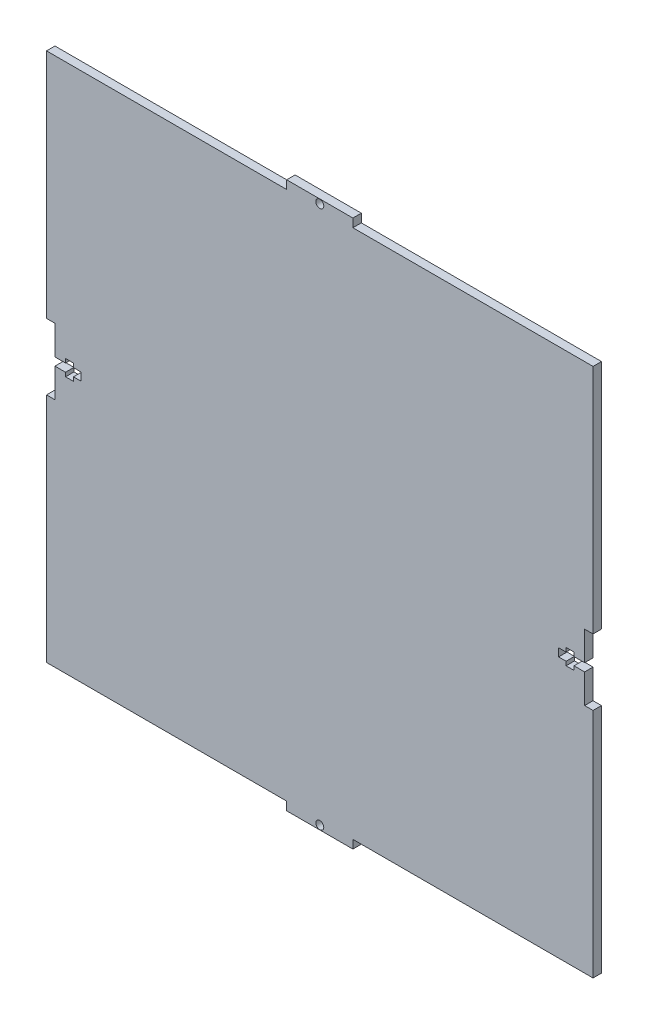
from build123d import *

# Parameters (mm, degrees)
SKETCH1_R           = 1.5
BOSS_EXTRUDE1_DEPTH = 3.18


with BuildPart() as part:
    # Sketch1 → Boss-Extrude1 (new body)
    with BuildSketch(Plane.XY):
        Polygon((-103.18, 100), (-12.5, 100), (-12.5, 103.18), (12.5, 103.18), (12.5, 100), (103.18, 100), (103.18, 12.5), (100, 12.5), (100, 1.5), (96, 1.5), (96, 3), (93, 3), (93, 1.5), (90.18, 1.5), (90.18, -1.5), (93, -1.5), (93, -3), (96, -3), (96, -1.5), (100, -1.5), (100, -12.5), (103.18, -12.5), (103.18, -100), (12.5, -100), (12.5, -103.18), (-12.5, -103.18), (-12.5, -100), (-103.18, -100), (-103.18, -12.5), (-100, -12.5), (-100, -1.5), (-96, -1.5), (-96, -3), (-93, -3), (-93, -1.5), (-90.18, -1.5), (-90.18, 1.5), (-93, 1.5), (-93, 3), (-96, 3), (-96, 1.5), (-100, 1.5), (-100, 12.5), (-103.18, 12.5), align=None)
        with Locations(Location((0, -101.59, 0), (0, 0, 180))):
            Circle(SKETCH1_R, mode=Mode.SUBTRACT)
        with Locations(Location((0, 101.59, 0), (0, 0, 180))):
            Circle(SKETCH1_R, mode=Mode.SUBTRACT)
    extrude(amount=BOSS_EXTRUDE1_DEPTH)


solid = part.part
